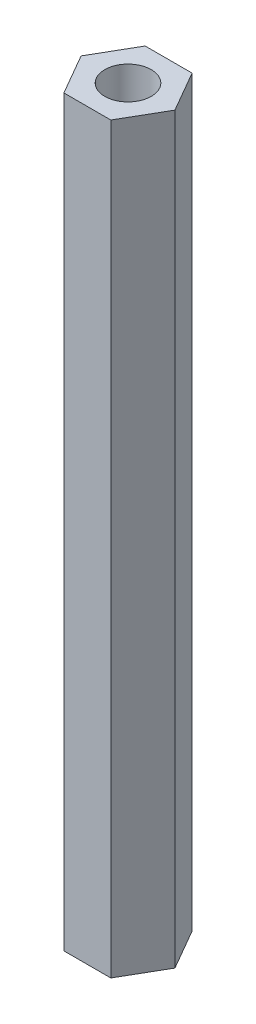
from build123d import *

# Parameters (mm, degrees)
SKETCH1_R           = 2
BOSS_EXTRUDE1_DEPTH = 64


with BuildPart() as part:
    # Sketch1 → Boss-Extrude1 (new body)
    with BuildSketch(Plane(origin=(0, 0, 0), x_dir=(1, 0, 0), z_dir=(0, 1, 0))):
        Polygon((2.020725942, 3.5), (-2.020725942, 3.5), (-4.041451884, 0), (-2.020725942, -3.5), (2.020725942, -3.5), (4.041451884, 0), align=None)
        with Locations(Location((0, 0, 0), (0, 0, 270))):
            Circle(SKETCH1_R, mode=Mode.SUBTRACT)
    extrude(amount=BOSS_EXTRUDE1_DEPTH)


solid = part.part
